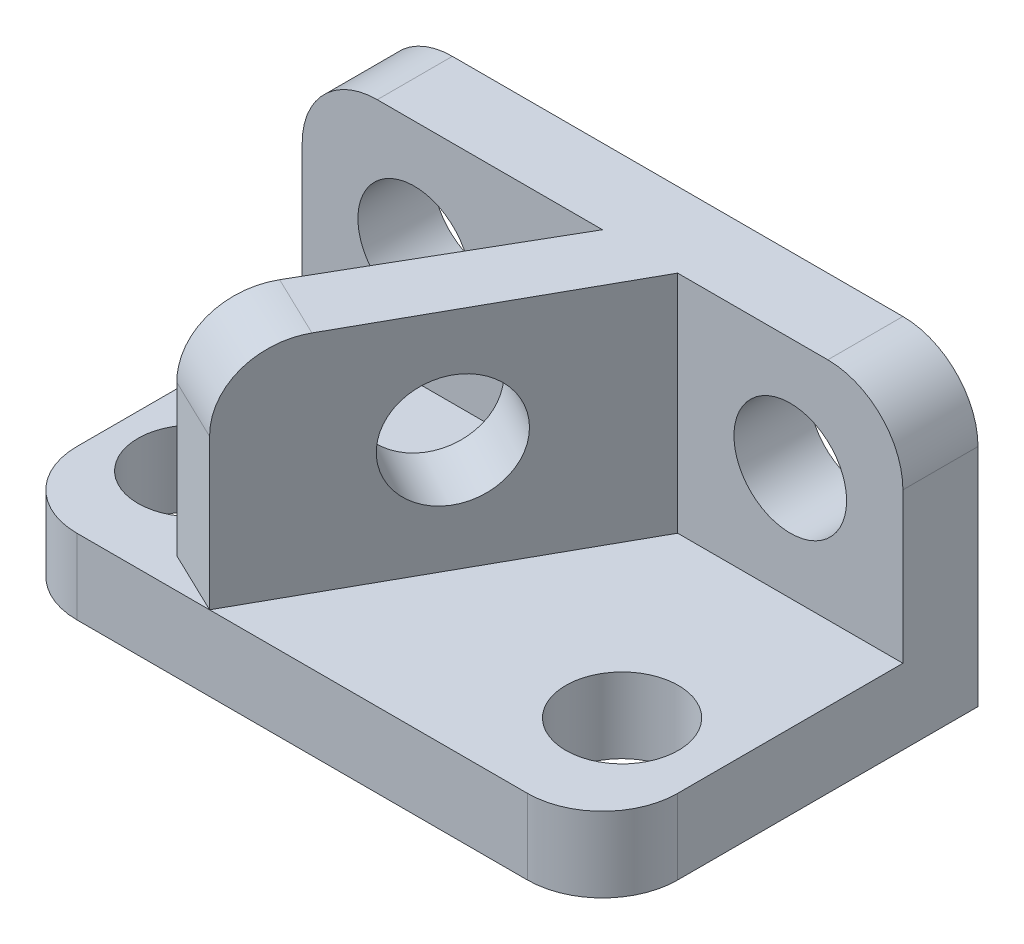
from build123d import *

# Parameters (mm, degrees)
SKETCH1_W           = 80
SKETCH1_H           = 10
BOSS_EXTRUDE1_DEPTH = 40
SKETCH3_W           = 80
SKETCH3_H           = 10
BOSS_EXTRUDE2_DEPTH = 40
BOSS_EXTRUDE6_DEPTH = 30
SKETCH8_R           = 7.5
CUT_EXTRUDE1_DEPTH  = 10
SKETCH9_R           = 7.5
CUT_EXTRUDE2_DEPTH  = 30
FILLET1_R           = 10
SKETCH10_R          = 7.5
CUT_EXTRUDE3_DEPTH  = 12


with BuildPart() as part:
    # Sketch1 → Boss-Extrude1 (new body)
    with BuildSketch(Plane(origin=(0, 0, 0), x_dir=(1, 0, 0), z_dir=(0, 1, 0))):
        with Locations((-45.97826087, 19.239130435)):
            Rectangle(SKETCH1_W, SKETCH1_H)
    extrude(amount=-BOSS_EXTRUDE1_DEPTH)

    # Sketch3 → Boss-Extrude2 (add)
    with BuildSketch(Plane.XY.offset(-14.239130435)):
        with Locations((-45.97826087, -35)):
            Rectangle(SKETCH3_W, SKETCH3_H)
    extrude(amount=BOSS_EXTRUDE2_DEPTH)

    # Sketch7 → Boss-Extrude6 (add)
    with BuildSketch(Plane(origin=(0, -30, 0), x_dir=(1, 0, 0), z_dir=(0, 1, 0))):
        Polygon((-35.97826087, 14.239130435), (-45.97826087, 14.239130435), (-66.731833313, -21.707111476), (-58.312851229, -25.760869565), align=None)
    extrude(amount=BOSS_EXTRUDE6_DEPTH)

    # Sketch8 → Cut-Extrude1 (cut)
    with BuildSketch(Plane(origin=(0, -30, 0), x_dir=(1, 0, 0), z_dir=(0, 1, 0))):
        with Locations(Location((-18.3763958, -10.760869565, 0), (0, 0, 270))):
            Circle(SKETCH8_R)
        with Locations(Location((-75.358914669, -10.760869565, 0), (0, 0, 270))):
            Circle(SKETCH8_R)
    extrude(amount=-CUT_EXTRUDE1_DEPTH, mode=Mode.SUBTRACT)

    # Sketch9 → Cut-Extrude2 (cut)
    with BuildSketch(Plane.XY.offset(-14.239130435)):
        with Locations((-20.97826087, -15)):
            Circle(SKETCH9_R)
        with Locations((-71.057215434, -15)):
            Circle(SKETCH9_R)
    extrude(amount=-CUT_EXTRUDE2_DEPTH, mode=Mode.SUBTRACT)

    # Fillet1
    fillet1_edges = [part.edges().sort_by_distance(p)[0] for p in [
        (-5.97826087, -35, 25.760869565),
        (-85.97826087, -35, 25.760869565),
        (-62.522342271, 0, 23.733990521),
        (-85.97826087, 0, -19.239130435),
        (-5.97826087, 0, -19.239130435),
    ]]
    fillet(fillet1_edges, radius=FILLET1_R)

    # Sketch10 → Cut-Extrude3 (cut)
    with BuildSketch(Plane(origin=(-33.488225208, 0, -18.698644797), x_dir=(0.48751608982422123, 0, -0.873114002958664), z_dir=(0.873114002958664, 0, 0.48751608982422123))):
        with Locations((-27.107596885, -15)):
            Circle(SKETCH10_R)
    extrude(amount=-CUT_EXTRUDE3_DEPTH, mode=Mode.SUBTRACT)


solid = part.part
